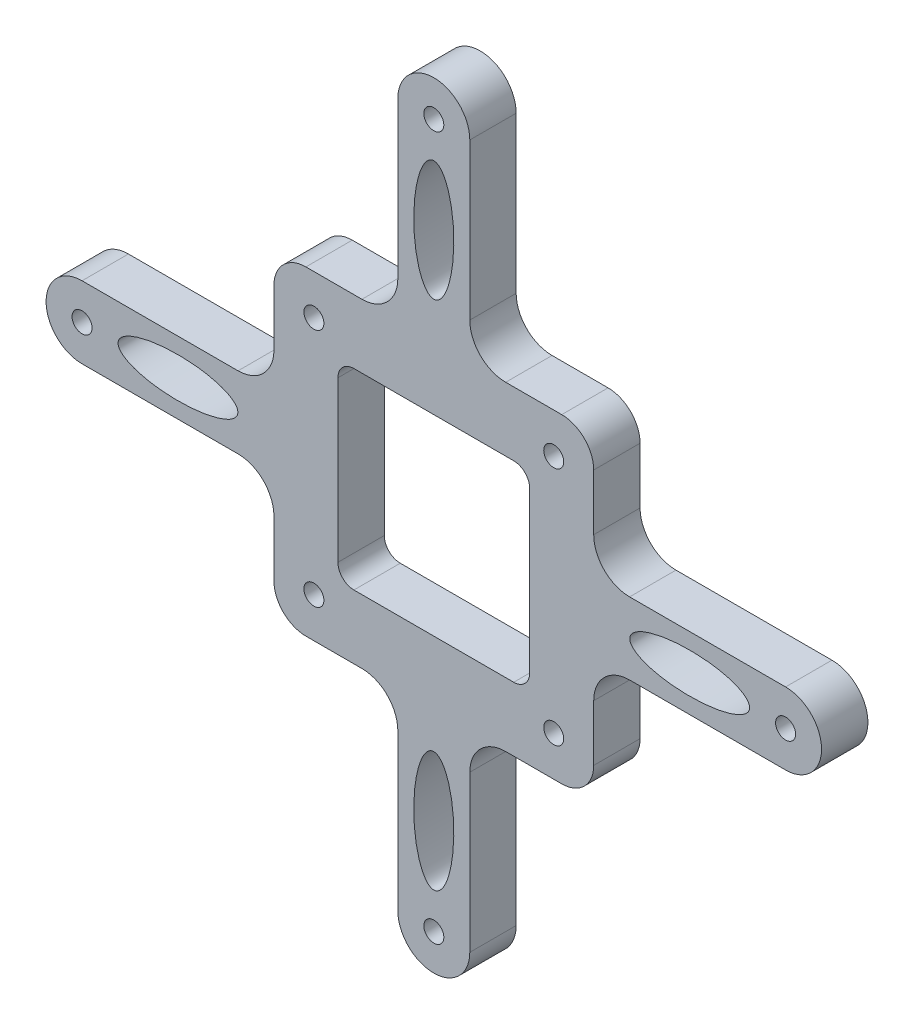
from build123d import *

# Parameters (mm, degrees)
SKETCH1_R           = 1.25
SKETCH1_RX          = 7.495001668
SKETCH1_RY          = 2.505000234
BOSS_EXTRUDE1_DEPTH = 5.8


with BuildPart() as part:
    # Sketch1 → Boss-Extrude1 (new body)
    with BuildSketch(Plane.XY):
        with BuildLine():
            Line((-16, 20), (-8.99, 20))
            ThreePointArc((-8.99, 20), (-5.815090552, 21.315090552), (-4.5, 24.49))
            Line((-4.5, 24.49), (-4.5, 44))
            ThreePointArc((-4.5, 44), (-3.181980515, 47.181980515), (0, 48.5))
            ThreePointArc((0, 48.5), (3.181980515, 47.181980515), (4.5, 44))
            Line((4.5, 44), (4.5, 24.49))
            ThreePointArc((4.5, 24.49), (5.815090552, 21.315090552), (8.99, 20))
            Line((8.99, 20), (16, 20))
            ThreePointArc((16, 20), (18.828427125, 18.828427125), (20, 16))
            Line((20, 16), (20, 8.99))
            ThreePointArc((20, 8.99), (21.315090552, 5.815090552), (24.49, 4.5))
            Line((24.49, 4.5), (44, 4.5))
            ThreePointArc((44, 4.5), (47.181980515, 3.181980515), (48.5, 0))
            ThreePointArc((48.5, 0), (47.181980515, -3.181980515), (44, -4.5))
            Line((44, -4.5), (24.49, -4.5))
            ThreePointArc((24.49, -4.5), (21.315090552, -5.815090552), (20, -8.99))
            Line((20, -8.99), (20, -16))
            ThreePointArc((20, -16), (18.828427125, -18.828427125), (16, -20))
            Line((16, -20), (8.99, -20))
            ThreePointArc((8.99, -20), (5.815090552, -21.315090552), (4.5, -24.49))
            Line((4.5, -24.49), (4.5, -44))
            ThreePointArc((4.5, -44), (3.181980515, -47.181980515), (0, -48.5))
            ThreePointArc((0, -48.5), (-3.181980515, -47.181980515), (-4.5, -44))
            Line((-4.5, -44), (-4.5, -24.49))
            ThreePointArc((-4.5, -24.49), (-5.815090552, -21.315090552), (-8.99, -20))
            Line((-8.99, -20), (-16, -20))
            ThreePointArc((-16, -20), (-18.828427125, -18.828427125), (-20, -16))
            Line((-20, -16), (-20, -8.99))
            ThreePointArc((-20, -8.99), (-21.315090552, -5.815090552), (-24.49, -4.5))
            Line((-24.49, -4.5), (-44, -4.5))
            ThreePointArc((-44, -4.5), (-47.181980515, -3.181980515), (-48.5, 0))
            ThreePointArc((-48.5, 0), (-47.181980515, 3.181980515), (-44, 4.5))
            Line((-44, 4.5), (-24.49, 4.5))
            ThreePointArc((-24.49, 4.5), (-21.315090552, 5.815090552), (-20, 8.99))
            Line((-20, 8.99), (-20, 16))
            ThreePointArc((-20, 16), (-18.828427125, 18.828427125), (-16, 20))
        make_face()
        with Locations((0, 44)):
            Circle(SKETCH1_R, mode=Mode.SUBTRACT)
        with Locations((-15, 15)):
            Circle(SKETCH1_R, mode=Mode.SUBTRACT)
        with Locations(Location((15, 15, 0), (0, 0, 180))):
            Circle(SKETCH1_R, mode=Mode.SUBTRACT)
        with Locations((15, -15)):
            Circle(SKETCH1_R, mode=Mode.SUBTRACT)
        with Locations(Location((-15, -15, 0), (0, 0, 180))):
            Circle(SKETCH1_R, mode=Mode.SUBTRACT)
        with Locations(Location((44, 0, 0), (0, 0, 180))):
            Circle(SKETCH1_R, mode=Mode.SUBTRACT)
        with Locations(Location((0, -44, 0), (0, 0, 180))):
            Circle(SKETCH1_R, mode=Mode.SUBTRACT)
        with Locations((-44, 0)):
            Circle(SKETCH1_R, mode=Mode.SUBTRACT)
        with Locations(Location((-0.004999676, 32.005), (0, 0, 89.961779812))):
            Ellipse(SKETCH1_RX, SKETCH1_RY, mode=Mode.SUBTRACT)
        with Locations(Location((32.005, -0.004999676), (0, 0, 0.038220188))):
            Ellipse(SKETCH1_RX, SKETCH1_RY, mode=Mode.SUBTRACT)
        with Locations(Location((-0.004999676, -32.005), (0, 0, -89.961779812))):
            Ellipse(SKETCH1_RX, SKETCH1_RY, mode=Mode.SUBTRACT)
        with Locations(Location((-32.005, -0.004999676), (0, 0, 179.961779812))):
            Ellipse(SKETCH1_RX, SKETCH1_RY, mode=Mode.SUBTRACT)
        with BuildLine():
            Line((9.99479618, -11.99479618), (-9.99479618, -11.99479618))
            ThreePointArc((-9.99479618, -11.99479618), (-11.409009742, -11.409009742), (-11.99479618, -9.99479618))
            Line((-11.99479618, -9.99479618), (-11.99479618, 9.99479618))
            ThreePointArc((-11.99479618, 9.99479618), (-11.409009742, 11.409009742), (-9.99479618, 11.99479618))
            Line((-9.99479618, 11.99479618), (9.99479618, 11.99479618))
            ThreePointArc((9.99479618, 11.99479618), (11.409009742, 11.409009742), (11.99479618, 9.99479618))
            Line((11.99479618, 9.99479618), (11.99479618, -9.99479618))
            ThreePointArc((11.99479618, -9.99479618), (11.409009742, -11.409009742), (9.99479618, -11.99479618))
        make_face(mode=Mode.SUBTRACT)
    extrude(amount=BOSS_EXTRUDE1_DEPTH)


solid = part.part
